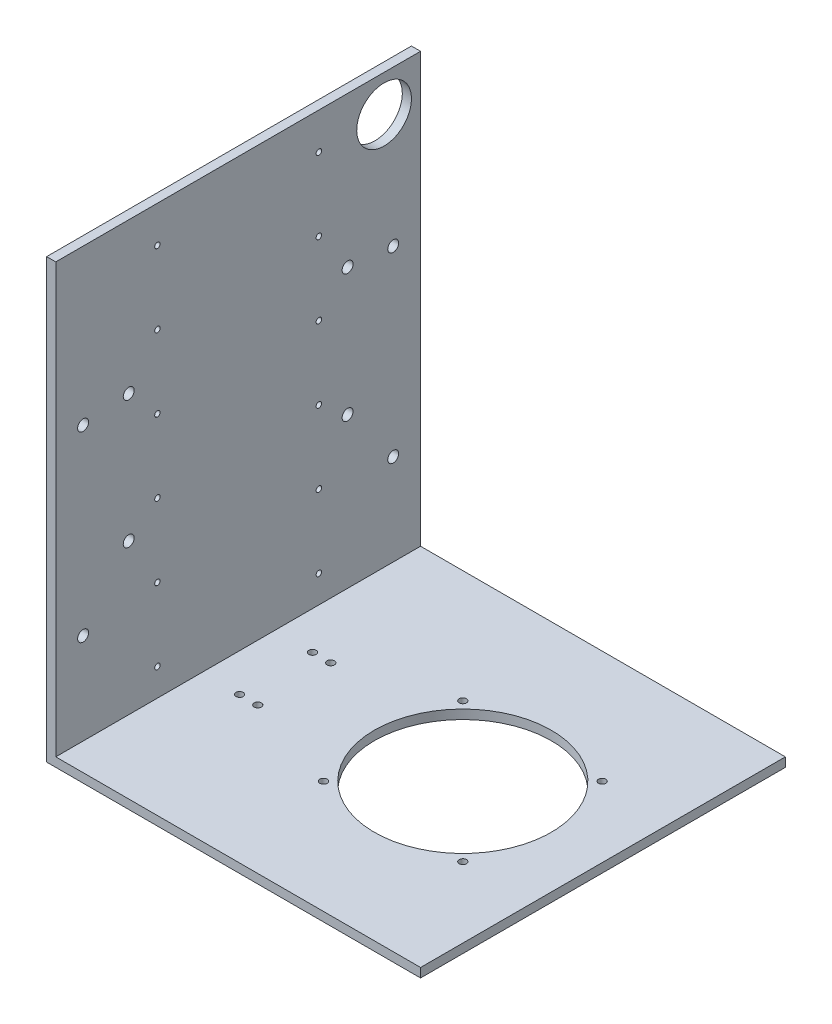
from build123d import *

# Parameters (mm, degrees)
BOSS_EXTRUDE1_DEPTH = 200
CUT_EXTRUDE1_REACH  = 372.473
SKETCH2_R           = 48.5
SKETCH2_R_2         = 2
CUT_EXTRUDE2_REACH  = 372.473
SKETCH3_R           = 2
SKETCH4_R           = 15
CUT_EXTRUDE3_DEPTH  = 10
CUT_EXTRUDE4_REACH  = 372.945
SKETCH5_R           = 3
CUT_EXTRUDE5_REACH  = 372.945
SKETCH6_R           = 1.5
CUT_EXTRUDE6_REACH  = 372.945
SKETCH8_R           = 3


with BuildPart() as part:
    # Sketch1 → Boss-Extrude1 (new body)
    with BuildSketch(Plane.XY):
        Polygon((0, 240), (0, 0), (205, 0), (205, 5), (5, 5), (5, 240), align=None)
    extrude(amount=BOSS_EXTRUDE1_DEPTH)

    # Sketch2 → Cut-Extrude1 (cut, up to next)
    with BuildSketch(Plane(origin=(0, 5, 0), x_dir=(1, 0, 0), z_dir=(0, 1, 0)), mode=Mode.PRIVATE) as cut_extrude1_sk1:
        with Locations(Location((128.16761425, -100, 0), (0, 0, 180))):
            Circle(SKETCH2_R)
    cut_extrude1_tool1 = extrude(cut_extrude1_sk1.sketch, amount=-CUT_EXTRUDE1_REACH, mode=Mode.PRIVATE) & part.part
    # Sketch2 → Cut-Extrude1 (cut, up to next)
    with BuildSketch(Plane(origin=(0, 5, 0), x_dir=(1, 0, 0), z_dir=(0, 1, 0)), mode=Mode.PRIVATE) as cut_extrude1_sk2:
        with Locations(Location((89.98261425, -61.817467672, 0), (0, 0, 180))):
            Circle(SKETCH2_R_2)
    cut_extrude1_tool2 = extrude(cut_extrude1_sk2.sketch, amount=-CUT_EXTRUDE1_REACH, mode=Mode.PRIVATE) & part.part
    # Sketch2 → Cut-Extrude1 (cut, up to next)
    with BuildSketch(Plane(origin=(0, 5, 0), x_dir=(1, 0, 0), z_dir=(0, 1, 0)), mode=Mode.PRIVATE) as cut_extrude1_sk3:
        with Locations(Location((166.35261425, -61.817467672, 0), (0, 0, 180))):
            Circle(SKETCH2_R_2)
    cut_extrude1_tool3 = extrude(cut_extrude1_sk3.sketch, amount=-CUT_EXTRUDE1_REACH, mode=Mode.PRIVATE) & part.part
    # Sketch2 → Cut-Extrude1 (cut, up to next)
    with BuildSketch(Plane(origin=(0, 5, 0), x_dir=(1, 0, 0), z_dir=(0, 1, 0)), mode=Mode.PRIVATE) as cut_extrude1_sk4:
        with Locations(Location((89.98261425, -138.182532328, 0), (0, 0, 180))):
            Circle(SKETCH2_R_2)
    cut_extrude1_tool4 = extrude(cut_extrude1_sk4.sketch, amount=-CUT_EXTRUDE1_REACH, mode=Mode.PRIVATE) & part.part
    # Sketch2 → Cut-Extrude1 (cut, up to next)
    with BuildSketch(Plane(origin=(0, 5, 0), x_dir=(1, 0, 0), z_dir=(0, 1, 0)), mode=Mode.PRIVATE) as cut_extrude1_sk5:
        with Locations(Location((166.35261425, -138.182532328, 0), (0, 0, 180))):
            Circle(SKETCH2_R_2)
    cut_extrude1_tool5 = extrude(cut_extrude1_sk5.sketch, amount=-CUT_EXTRUDE1_REACH, mode=Mode.PRIVATE) & part.part
    add(cut_extrude1_tool1.solids().sort_by_distance((128.167614, 5, 100))[0], mode=Mode.SUBTRACT)
    add(cut_extrude1_tool2.solids().sort_by_distance((89.982614, 5, 61.817468))[0], mode=Mode.SUBTRACT)
    add(cut_extrude1_tool3.solids().sort_by_distance((166.352614, 5, 61.817468))[0], mode=Mode.SUBTRACT)
    add(cut_extrude1_tool4.solids().sort_by_distance((89.982614, 5, 138.182532))[0], mode=Mode.SUBTRACT)
    add(cut_extrude1_tool5.solids().sort_by_distance((166.352614, 5, 138.182532))[0], mode=Mode.SUBTRACT)

    # Sketch3 → Cut-Extrude2 (cut, up to next)
    with BuildSketch(Plane(origin=(0, 5, 0), x_dir=(1, 0, 0), z_dir=(0, 1, 0)), mode=Mode.PRIVATE) as cut_extrude2_sk1:
        with Locations(Location((25.75, -80, 0), (0, 0, 180))):
            Circle(SKETCH3_R)
    cut_extrude2_tool1 = extrude(cut_extrude2_sk1.sketch, amount=-CUT_EXTRUDE2_REACH, mode=Mode.PRIVATE) & part.part
    # Sketch3 → Cut-Extrude2 (cut, up to next)
    with BuildSketch(Plane(origin=(0, 5, 0), x_dir=(1, 0, 0), z_dir=(0, 1, 0)), mode=Mode.PRIVATE) as cut_extrude2_sk2:
        with Locations(Location((25.75, -120, 0), (0, 0, 270))):
            Circle(SKETCH3_R)
    cut_extrude2_tool2 = extrude(cut_extrude2_sk2.sketch, amount=-CUT_EXTRUDE2_REACH, mode=Mode.PRIVATE) & part.part
    # Sketch3 → Cut-Extrude2 (cut, up to next)
    with BuildSketch(Plane(origin=(0, 5, 0), x_dir=(1, 0, 0), z_dir=(0, 1, 0)), mode=Mode.PRIVATE) as cut_extrude2_sk3:
        with Locations(Location((35.75, -120, 0), (0, 0, 180))):
            Circle(SKETCH3_R)
    cut_extrude2_tool3 = extrude(cut_extrude2_sk3.sketch, amount=-CUT_EXTRUDE2_REACH, mode=Mode.PRIVATE) & part.part
    # Sketch3 → Cut-Extrude2 (cut, up to next)
    with BuildSketch(Plane(origin=(0, 5, 0), x_dir=(1, 0, 0), z_dir=(0, 1, 0)), mode=Mode.PRIVATE) as cut_extrude2_sk4:
        with Locations(Location((35.75, -80, 0), (0, 0, 270))):
            Circle(SKETCH3_R)
    cut_extrude2_tool4 = extrude(cut_extrude2_sk4.sketch, amount=-CUT_EXTRUDE2_REACH, mode=Mode.PRIVATE) & part.part
    add(cut_extrude2_tool1.solids().sort_by_distance((25.75, 5, 80))[0], mode=Mode.SUBTRACT)
    add(cut_extrude2_tool2.solids().sort_by_distance((25.75, 5, 120))[0], mode=Mode.SUBTRACT)
    add(cut_extrude2_tool3.solids().sort_by_distance((35.75, 5, 120))[0], mode=Mode.SUBTRACT)
    add(cut_extrude2_tool4.solids().sort_by_distance((35.75, 5, 80))[0], mode=Mode.SUBTRACT)

    # Sketch4 → Cut-Extrude3 (cut)
    with BuildSketch(Plane(origin=(5, 0, 0), x_dir=(0, 0, -1), z_dir=(1, 0, 0))):
        with Locations(Location((-20, 220, 0), (0, 0, 90))):
            Circle(SKETCH4_R)
    extrude(amount=-CUT_EXTRUDE3_DEPTH, mode=Mode.SUBTRACT)

    # Sketch5 → Cut-Extrude4 (cut, up to next)
    with BuildSketch(Plane(origin=(5, 0, 0), x_dir=(0, 0, -1), z_dir=(1, 0, 0)), mode=Mode.PRIVATE) as cut_extrude4_sk1:
        with Locations(Location((-185, 55, 0), (0, 0, 90))):
            Circle(SKETCH5_R)
    cut_extrude4_tool1 = extrude(cut_extrude4_sk1.sketch, amount=-CUT_EXTRUDE4_REACH, mode=Mode.PRIVATE) & part.part
    # Sketch5 → Cut-Extrude4 (cut, up to next)
    with BuildSketch(Plane(origin=(5, 0, 0), x_dir=(0, 0, -1), z_dir=(1, 0, 0)), mode=Mode.PRIVATE) as cut_extrude4_sk2:
        with Locations(Location((-185, 155, 0), (0, 0, 90))):
            Circle(SKETCH5_R)
    cut_extrude4_tool2 = extrude(cut_extrude4_sk2.sketch, amount=-CUT_EXTRUDE4_REACH, mode=Mode.PRIVATE) & part.part
    # Sketch5 → Cut-Extrude4 (cut, up to next)
    with BuildSketch(Plane(origin=(5, 0, 0), x_dir=(0, 0, -1), z_dir=(1, 0, 0)), mode=Mode.PRIVATE) as cut_extrude4_sk3:
        with Locations(Location((-15, 55, 0), (0, 0, 90))):
            Circle(SKETCH5_R)
    cut_extrude4_tool3 = extrude(cut_extrude4_sk3.sketch, amount=-CUT_EXTRUDE4_REACH, mode=Mode.PRIVATE) & part.part
    # Sketch5 → Cut-Extrude4 (cut, up to next)
    with BuildSketch(Plane(origin=(5, 0, 0), x_dir=(0, 0, -1), z_dir=(1, 0, 0)), mode=Mode.PRIVATE) as cut_extrude4_sk4:
        with Locations(Location((-15, 155, 0), (0, 0, 90))):
            Circle(SKETCH5_R)
    cut_extrude4_tool4 = extrude(cut_extrude4_sk4.sketch, amount=-CUT_EXTRUDE4_REACH, mode=Mode.PRIVATE) & part.part
    add(cut_extrude4_tool1.solids().sort_by_distance((5, 55, 185))[0], mode=Mode.SUBTRACT)
    add(cut_extrude4_tool2.solids().sort_by_distance((5, 155, 185))[0], mode=Mode.SUBTRACT)
    add(cut_extrude4_tool3.solids().sort_by_distance((5, 55, 15))[0], mode=Mode.SUBTRACT)
    add(cut_extrude4_tool4.solids().sort_by_distance((5, 155, 15))[0], mode=Mode.SUBTRACT)

    # Sketch6 → Cut-Extrude5 (cut, up to next)
    with BuildSketch(Plane(origin=(5, 0, 0), x_dir=(0, 0, -1), z_dir=(1, 0, 0)), mode=Mode.PRIVATE) as cut_extrude5_sk1:
        with Locations(Location((-144.25, 220, 0), (0, 0, 90))):
            Circle(SKETCH6_R)
    cut_extrude5_tool1 = extrude(cut_extrude5_sk1.sketch, amount=-CUT_EXTRUDE5_REACH, mode=Mode.PRIVATE) & part.part
    # Sketch6 → Cut-Extrude5 (cut, up to next)
    with BuildSketch(Plane(origin=(5, 0, 0), x_dir=(0, 0, -1), z_dir=(1, 0, 0)), mode=Mode.PRIVATE) as cut_extrude5_sk2:
        with Locations(Location((-55.75, 220, 0), (0, 0, 90))):
            Circle(SKETCH6_R)
    cut_extrude5_tool2 = extrude(cut_extrude5_sk2.sketch, amount=-CUT_EXTRUDE5_REACH, mode=Mode.PRIVATE) & part.part
    # Sketch6 → Cut-Extrude5 (cut, up to next)
    with BuildSketch(Plane(origin=(5, 0, 0), x_dir=(0, 0, -1), z_dir=(1, 0, 0)), mode=Mode.PRIVATE) as cut_extrude5_sk3:
        with Locations(Location((-144.25, 180, 0), (0, 0, 90))):
            Circle(SKETCH6_R)
    cut_extrude5_tool3 = extrude(cut_extrude5_sk3.sketch, amount=-CUT_EXTRUDE5_REACH, mode=Mode.PRIVATE) & part.part
    # Sketch6 → Cut-Extrude5 (cut, up to next)
    with BuildSketch(Plane(origin=(5, 0, 0), x_dir=(0, 0, -1), z_dir=(1, 0, 0)), mode=Mode.PRIVATE) as cut_extrude5_sk4:
        with Locations(Location((-55.75, 180, 0), (0, 0, 90))):
            Circle(SKETCH6_R)
    cut_extrude5_tool4 = extrude(cut_extrude5_sk4.sketch, amount=-CUT_EXTRUDE5_REACH, mode=Mode.PRIVATE) & part.part
    # Sketch6 → Cut-Extrude5 (cut, up to next)
    with BuildSketch(Plane(origin=(5, 0, 0), x_dir=(0, 0, -1), z_dir=(1, 0, 0)), mode=Mode.PRIVATE) as cut_extrude5_sk5:
        with Locations(Location((-144.25, 140, 0), (0, 0, 90))):
            Circle(SKETCH6_R)
    cut_extrude5_tool5 = extrude(cut_extrude5_sk5.sketch, amount=-CUT_EXTRUDE5_REACH, mode=Mode.PRIVATE) & part.part
    # Sketch6 → Cut-Extrude5 (cut, up to next)
    with BuildSketch(Plane(origin=(5, 0, 0), x_dir=(0, 0, -1), z_dir=(1, 0, 0)), mode=Mode.PRIVATE) as cut_extrude5_sk6:
        with Locations(Location((-55.75, 140, 0), (0, 0, 90))):
            Circle(SKETCH6_R)
    cut_extrude5_tool6 = extrude(cut_extrude5_sk6.sketch, amount=-CUT_EXTRUDE5_REACH, mode=Mode.PRIVATE) & part.part
    # Sketch6 → Cut-Extrude5 (cut, up to next)
    with BuildSketch(Plane(origin=(5, 0, 0), x_dir=(0, 0, -1), z_dir=(1, 0, 0)), mode=Mode.PRIVATE) as cut_extrude5_sk7:
        with Locations(Location((-144.25, 100, 0), (0, 0, 90))):
            Circle(SKETCH6_R)
    cut_extrude5_tool7 = extrude(cut_extrude5_sk7.sketch, amount=-CUT_EXTRUDE5_REACH, mode=Mode.PRIVATE) & part.part
    # Sketch6 → Cut-Extrude5 (cut, up to next)
    with BuildSketch(Plane(origin=(5, 0, 0), x_dir=(0, 0, -1), z_dir=(1, 0, 0)), mode=Mode.PRIVATE) as cut_extrude5_sk8:
        with Locations(Location((-55.75, 100, 0), (0, 0, 90))):
            Circle(SKETCH6_R)
    cut_extrude5_tool8 = extrude(cut_extrude5_sk8.sketch, amount=-CUT_EXTRUDE5_REACH, mode=Mode.PRIVATE) & part.part
    # Sketch6 → Cut-Extrude5 (cut, up to next)
    with BuildSketch(Plane(origin=(5, 0, 0), x_dir=(0, 0, -1), z_dir=(1, 0, 0)), mode=Mode.PRIVATE) as cut_extrude5_sk9:
        with Locations(Location((-144.25, 60, 0), (0, 0, 90))):
            Circle(SKETCH6_R)
    cut_extrude5_tool9 = extrude(cut_extrude5_sk9.sketch, amount=-CUT_EXTRUDE5_REACH, mode=Mode.PRIVATE) & part.part
    # Sketch6 → Cut-Extrude5 (cut, up to next)
    with BuildSketch(Plane(origin=(5, 0, 0), x_dir=(0, 0, -1), z_dir=(1, 0, 0)), mode=Mode.PRIVATE) as cut_extrude5_sk10:
        with Locations(Location((-55.75, 60, 0), (0, 0, 90))):
            Circle(SKETCH6_R)
    cut_extrude5_tool10 = extrude(cut_extrude5_sk10.sketch, amount=-CUT_EXTRUDE5_REACH, mode=Mode.PRIVATE) & part.part
    # Sketch6 → Cut-Extrude5 (cut, up to next)
    with BuildSketch(Plane(origin=(5, 0, 0), x_dir=(0, 0, -1), z_dir=(1, 0, 0)), mode=Mode.PRIVATE) as cut_extrude5_sk11:
        with Locations(Location((-144.25, 20, 0), (0, 0, 90))):
            Circle(SKETCH6_R)
    cut_extrude5_tool11 = extrude(cut_extrude5_sk11.sketch, amount=-CUT_EXTRUDE5_REACH, mode=Mode.PRIVATE) & part.part
    # Sketch6 → Cut-Extrude5 (cut, up to next)
    with BuildSketch(Plane(origin=(5, 0, 0), x_dir=(0, 0, -1), z_dir=(1, 0, 0)), mode=Mode.PRIVATE) as cut_extrude5_sk12:
        with Locations(Location((-55.75, 20, 0), (0, 0, 90))):
            Circle(SKETCH6_R)
    cut_extrude5_tool12 = extrude(cut_extrude5_sk12.sketch, amount=-CUT_EXTRUDE5_REACH, mode=Mode.PRIVATE) & part.part
    add(cut_extrude5_tool1.solids().sort_by_distance((5, 220, 144.25))[0], mode=Mode.SUBTRACT)
    add(cut_extrude5_tool2.solids().sort_by_distance((5, 220, 55.75))[0], mode=Mode.SUBTRACT)
    add(cut_extrude5_tool3.solids().sort_by_distance((5, 180, 144.25))[0], mode=Mode.SUBTRACT)
    add(cut_extrude5_tool4.solids().sort_by_distance((5, 180, 55.75))[0], mode=Mode.SUBTRACT)
    add(cut_extrude5_tool5.solids().sort_by_distance((5, 140, 144.25))[0], mode=Mode.SUBTRACT)
    add(cut_extrude5_tool6.solids().sort_by_distance((5, 140, 55.75))[0], mode=Mode.SUBTRACT)
    add(cut_extrude5_tool7.solids().sort_by_distance((5, 100, 144.25))[0], mode=Mode.SUBTRACT)
    add(cut_extrude5_tool8.solids().sort_by_distance((5, 100, 55.75))[0], mode=Mode.SUBTRACT)
    add(cut_extrude5_tool9.solids().sort_by_distance((5, 60, 144.25))[0], mode=Mode.SUBTRACT)
    add(cut_extrude5_tool10.solids().sort_by_distance((5, 60, 55.75))[0], mode=Mode.SUBTRACT)
    add(cut_extrude5_tool11.solids().sort_by_distance((5, 20, 144.25))[0], mode=Mode.SUBTRACT)
    add(cut_extrude5_tool12.solids().sort_by_distance((5, 20, 55.75))[0], mode=Mode.SUBTRACT)

    # Sketch8 → Cut-Extrude6 (cut, up to next)
    with BuildSketch(Plane(origin=(5, 0, 0), x_dir=(0, 0, -1), z_dir=(1, 0, 0)), mode=Mode.PRIVATE) as cut_extrude6_sk1:
        with Locations(Location((-160, 157.5, 0), (0, 0, 90))):
            Circle(SKETCH8_R)
    cut_extrude6_tool1 = extrude(cut_extrude6_sk1.sketch, amount=-CUT_EXTRUDE6_REACH, mode=Mode.PRIVATE) & part.part
    # Sketch8 → Cut-Extrude6 (cut, up to next)
    with BuildSketch(Plane(origin=(5, 0, 0), x_dir=(0, 0, -1), z_dir=(1, 0, 0)), mode=Mode.PRIVATE) as cut_extrude6_sk2:
        with Locations(Location((-40, 157.5, 0), (0, 0, 90))):
            Circle(SKETCH8_R)
    cut_extrude6_tool2 = extrude(cut_extrude6_sk2.sketch, amount=-CUT_EXTRUDE6_REACH, mode=Mode.PRIVATE) & part.part
    # Sketch8 → Cut-Extrude6 (cut, up to next)
    with BuildSketch(Plane(origin=(5, 0, 0), x_dir=(0, 0, -1), z_dir=(1, 0, 0)), mode=Mode.PRIVATE) as cut_extrude6_sk3:
        with Locations(Location((-40, 87.5, 0), (0, 0, 90))):
            Circle(SKETCH8_R)
    cut_extrude6_tool3 = extrude(cut_extrude6_sk3.sketch, amount=-CUT_EXTRUDE6_REACH, mode=Mode.PRIVATE) & part.part
    # Sketch8 → Cut-Extrude6 (cut, up to next)
    with BuildSketch(Plane(origin=(5, 0, 0), x_dir=(0, 0, -1), z_dir=(1, 0, 0)), mode=Mode.PRIVATE) as cut_extrude6_sk4:
        with Locations(Location((-160, 87.5, 0), (0, 0, 90))):
            Circle(SKETCH8_R)
    cut_extrude6_tool4 = extrude(cut_extrude6_sk4.sketch, amount=-CUT_EXTRUDE6_REACH, mode=Mode.PRIVATE) & part.part
    add(cut_extrude6_tool1.solids().sort_by_distance((5, 157.5, 160))[0], mode=Mode.SUBTRACT)
    add(cut_extrude6_tool2.solids().sort_by_distance((5, 157.5, 40))[0], mode=Mode.SUBTRACT)
    add(cut_extrude6_tool3.solids().sort_by_distance((5, 87.5, 40))[0], mode=Mode.SUBTRACT)
    add(cut_extrude6_tool4.solids().sort_by_distance((5, 87.5, 160))[0], mode=Mode.SUBTRACT)


solid = part.part
